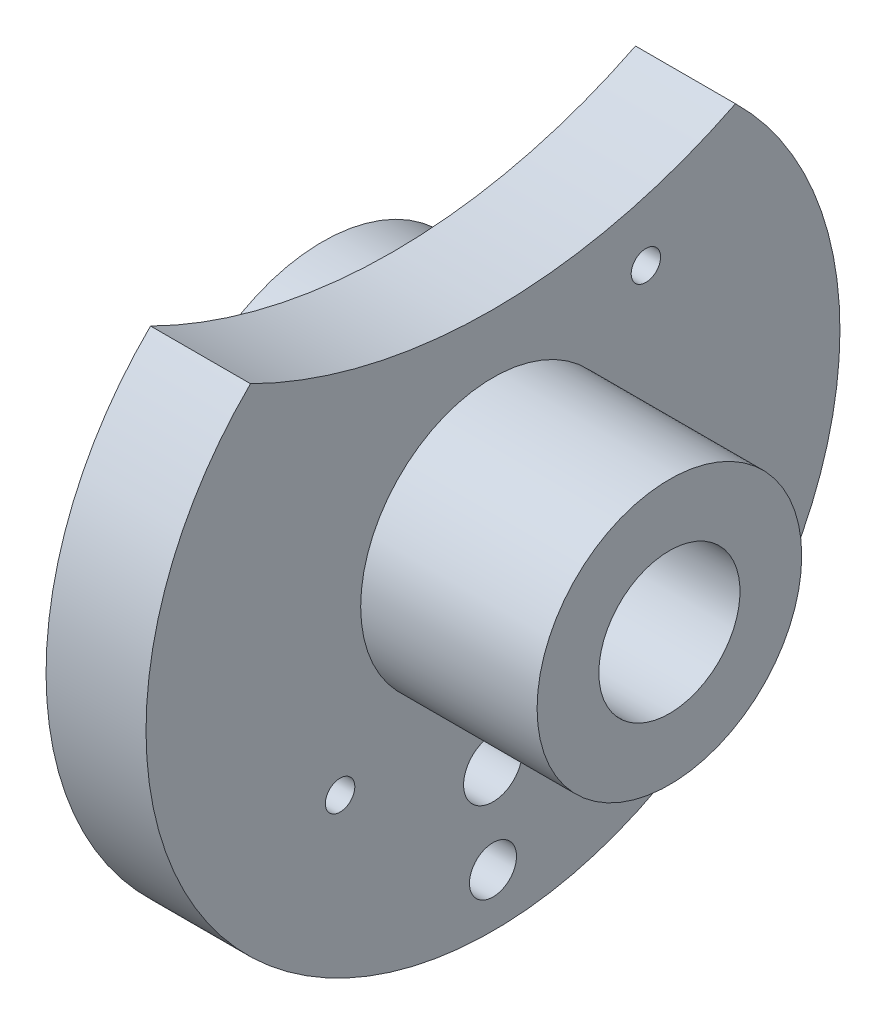
from build123d import *

# Parameters (mm, degrees)
ESQUISSE2_R             = 92.5
ENL_V_MAT_EXTRU_1_DEPTH = 96.765338197
ESQUISSE6_R             = 5
ESQUISSE6_R_2           = 4
ENL_V_MAT_EXTRU_2_DEPTH = 96.765338197
ESQUISSE7_R             = 2.5
ENL_V_MAT_EXTRU_3_DEPTH = 96.765338197


with BuildPart() as part:
    # Esquisse1 → Base-Révolution (revolve)
    with BuildSketch(Plane.XY, mode=Mode.PRIVATE) as base_r_volution_sk:
        Polygon((0, 24), (0, 28), (12, 28), (12, 59), (29, 59), (29, 22.5), (59, 22.5), (59, 12), (19, 12), (19, 24), align=None)
    revolve(base_r_volution_sk.sketch.rotate(Axis((-50, 0, 0), (1, 0, 0)), 90), axis=Axis((-50, 0, 0), (1, 0, 0)))

    # Esquisse2 → Enlèv. mat.-Extru.1 (cut, through all)
    with BuildSketch(Plane.ZY.offset(-12)):
        with Locations((0, 125)):
            Circle(ESQUISSE2_R)
    extrude(amount=-ENL_V_MAT_EXTRU_1_DEPTH, mode=Mode.SUBTRACT)

    # Esquisse6 → Enlèv. mat.-Extru.2 (cut, through all)
    with BuildSketch(Plane.ZY.offset(-12)):
        with Locations((0, -35)):
            Circle(ESQUISSE6_R)
        with Locations((0, -50)):
            Circle(ESQUISSE6_R_2)
    extrude(amount=-ENL_V_MAT_EXTRU_2_DEPTH, mode=Mode.SUBTRACT)

    # Esquisse7 → Enlèv. mat.-Extru.3 (cut, through all)
    with BuildSketch(Plane.ZY.offset(-12)):
        with Locations((-26, 26)):
            Circle(ESQUISSE7_R)
        with Locations((26, -26)):
            Circle(ESQUISSE7_R)
    extrude(amount=-ENL_V_MAT_EXTRU_3_DEPTH, mode=Mode.SUBTRACT)


solid = part.part
